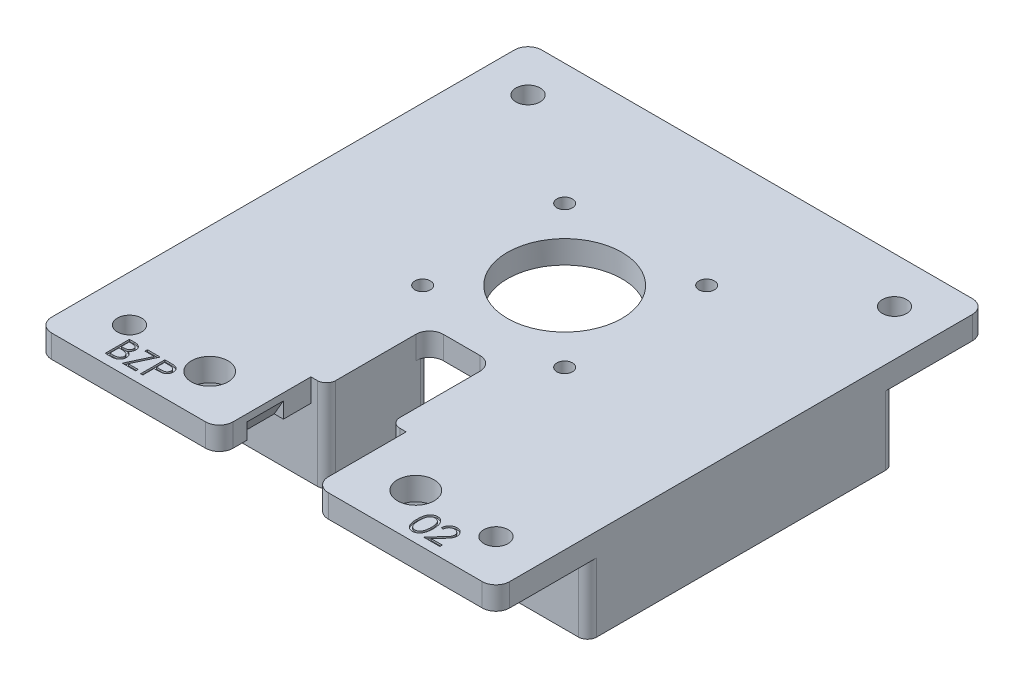
from build123d import *

# Parameters (mm, degrees)
SKETCH2_W               = 100
SKETCH2_H               = 107
BOSS_EXTRUDE1_DEPTH     = 5
CUT_EXTRUDE1_DEPTH      = 147.540096902
CUT_EXTRUDE1_DEPTH_BACK = 147.540096902
SKETCH3_R               = 12.5
SKETCH3_R_2             = 1.7
SKETCH3_R_3             = 4
M5_CLEARANCE_HOLE1_D    = 5.3
FILLET1_R               = 3
BOSS_EXTRUDE2_DEPTH     = 15
FILLET3_R               = 3
FILLET4_R               = 2
CUT_EXTRUDE2_DEPTH      = 4
CUT_EXTRUDE2_DEPTH_BACK = 4
CUT_EXTRUDE3_DEPTH      = 0.4
CUT_EXTRUDE4_DEPTH      = 0.4


with BuildPart() as part:
    # Sketch2 → Boss-Extrude1 (new body)
    with BuildSketch(Plane(origin=(0, 0, 0), x_dir=(1, 0, 0), z_dir=(0, 1, 0))):
        with Locations((50, 53.5)):
            Rectangle(SKETCH2_W, SKETCH2_H)
    extrude(amount=BOSS_EXTRUDE1_DEPTH)

    # Sketch3 → Cut-Extrude1 (cut, two sides: drawn at the far end of the back side and taken through both)
    with BuildSketch(Plane(origin=(0, 5, 0), x_dir=(1, 0, 0), z_dir=(0, 1, 0)).offset(-CUT_EXTRUDE1_DEPTH_BACK)):
        with Locations(Location((50, 65, 0), (0, 0, 270))):
            Circle(SKETCH3_R)
        with Locations(Location((65.5, 49.5, 0), (0, 0, 270))):
            Circle(SKETCH3_R_2)
        with Locations(Location((34.5, 49.5, 0), (0, 0, 270))):
            Circle(SKETCH3_R_2)
        with Locations(Location((65.5, 80.5, 0), (0, 0, 270))):
            Circle(SKETCH3_R_2)
        with Locations(Location((34.5, 80.5, 0), (0, 0, 270))):
            Circle(SKETCH3_R_2)
        with Locations(Location((27.5, 10, 0), (0, 0, 270))):
            Circle(SKETCH3_R_3)
        with Locations(Location((72.5, 10, 0), (0, 0, 90))):
            Circle(SKETCH3_R_3)
        Polygon((39.6, 0), (39.6, 20), (43, 20), (43, 42.5), (57, 42.5), (57, 20), (60.4, 20), (60.4, 0), align=None)
    extrude(amount=CUT_EXTRUDE1_DEPTH + CUT_EXTRUDE1_DEPTH_BACK, mode=Mode.SUBTRACT)

    # M5 Clearance Hole1 (through all)
    with Locations(Plane(origin=(0, 5, 0), x_dir=(1, 0, 0), z_dir=(0, 1, 0))):
        with Locations((10, 97), (10, 10), (90, 10), (90, 97)):
            Hole(M5_CLEARANCE_HOLE1_D / 2)

    # Fillet1
    fillet1_edges = [part.edges().sort_by_distance(p)[0] for p in [
        (60.4, 2.5, 0),
        (39.6, 2.5, 0),
        (43, 2.5, -42.5),
        (57, 2.5, -42.5),
        (0, 2.5, -107),
        (100, 2.5, -107),
        (100, 2.5, 0),
        (0, 2.5, 0),
    ]]
    fillet(fillet1_edges, radius=FILLET1_R)

    # Sketch7 → Boss-Extrude2 (add)
    with BuildSketch(Plane.XZ):
        Polygon((57, -20), (100, -20), (100, -87), (84, -87), (84, -82), (95, -82), (95, -25), (62, -25), (62, -42.5), (57, -42.5), (57, -25), align=None)
        Polygon((43, -25), (43, -20), (0, -20), (0, -87), (16, -87), (16, -82), (5, -82), (5, -25), (38, -25), (38, -42.5), (43, -42.5), align=None)
    extrude(amount=BOSS_EXTRUDE2_DEPTH)

    # Fillet3
    fillet3_edges = [part.edges().sort_by_distance(p)[0] for p in [
        (62, -7.5, -25),
        (95, -7.5, -25),
        (95, -7.5, -82),
        (5, -7.5, -82),
        (5, -7.5, -25),
        (38, -7.5, -25),
    ]]
    fillet(fillet3_edges, radius=FILLET3_R)

    # Fillet4
    fillet4_edges = [part.edges().sort_by_distance(p)[0] for p in [
        (57, -7.5, -42.5),
        (62, -7.5, -42.5),
        (84, -7.5, -82),
        (84, -7.5, -87),
        (100, -7.5, -87),
        (100, -7.5, -20),
        (43, -7.5, -42.5),
        (0, -7.5, -20),
        (0, -7.5, -87),
        (16, -7.5, -87),
        (16, -7.5, -82),
        (38, -7.5, -42.5),
        (43, -5, -20),
        (57, -5, -20),
    ]]
    fillet(fillet4_edges, radius=FILLET4_R)

    # Sketch9 → Cut-Extrude2 (cut, two sides: drawn at the far end of the back side and taken through both)
    with BuildSketch(Plane.XY.offset(-10).offset(-CUT_EXTRUDE2_DEPTH_BACK)):
        Polygon((39.6, 0), (39.6, 3.464101615), (37.6, 0), align=None)
        Polygon((60.4, 0), (62.4, 0), (60.4, 3.464101615), align=None)
    extrude(amount=CUT_EXTRUDE2_DEPTH + CUT_EXTRUDE2_DEPTH_BACK, mode=Mode.SUBTRACT)

    # Sketch10 → Cut-Extrude3 (cut)
    # profile 1 of 3: a face of its own
    with BuildSketch(Plane(origin=(0, 5, 0), x_dir=(1, 0, 0), z_dir=(0, 1, 0))):
        with BuildLine():
            Line((12.690491453, 7.291666667), (13.722960069, 7.291666667))
            add(Edge.make_bspline(
                [(13.722960069, 7.291666667), (13.773500745, 7.291400949), (13.871461152, 7.290885921), (14.013911975, 7.28289833), (14.147335772, 7.272007068), (14.271771237, 7.254725856), (14.387160871, 7.233874002), (14.493852417, 7.208622447), (14.591506606, 7.178344115), (14.70809372, 7.13019557), (14.841021386, 7.058647447), (14.984952289, 6.952922116), (15.108027746, 6.823605178), (15.214142773, 6.677732592), (15.298508752, 6.517265413), (15.359543285, 6.346028306), (15.398184358, 6.166229958), (15.4021583, 6.042793249), (15.404166667, 5.980410323)],
                knots=[0, 0, 0, 0, 1.001505555, 1.941167018, 2.826882275, 3.653841531, 4.429895133, 5.150066043, 5.825578002, 6.45369114, 7.647487171, 8.808567382, 9.977351308, 11.170798116, 12.373658725, 13.556498008, 14.765093433, 16, 16, 16, 16], degree=3))
            add(Edge.make_bspline(
                [(15.404166667, 5.980410323), (15.402513824, 5.92197134), (15.399265834, 5.807133228), (15.368207138, 5.639169515), (15.31958327, 5.479283743), (15.251993191, 5.328059423), (15.164148507, 5.188913365), (15.060041287, 5.060723093), (14.934437073, 4.948916138), (14.840331222, 4.886409607), (14.792529714, 4.854659121)],
                knots=[0, 0, 0, 0, 1.044552857, 2.05264487, 3.044412934, 4.028983338, 5.005914585, 5.980388656, 6.974128949, 8, 8, 8, 8], degree=3))
            add(Edge.make_bspline(
                [(14.792529714, 4.854659121), (14.852643694, 4.831579897), (14.967656629, 4.787423623), (15.125931909, 4.709355719), (15.262297925, 4.624443957), (15.377803134, 4.531716041), (15.476587446, 4.431765815), (15.56284606, 4.323127725), (15.636447661, 4.204384603), (15.699513629, 4.076774496), (15.748724248, 3.941600431), (15.785578294, 3.800130329), (15.806695747, 3.652871478), (15.809700871, 3.552654297), (15.811217949, 3.502061632)],
                knots=[0, 0, 0, 0, 1.27268992, 2.434971085, 3.483601985, 4.442670788, 5.356604649, 6.2567628, 7.179492994, 8.113709626, 9.066344395, 10.018646069, 10.999752585, 12, 12, 12, 12], degree=3))
            add(Edge.make_bspline(
                [(15.811217949, 3.502061632), (15.809741051, 3.450404575), (15.806835212, 3.348767869), (15.785396445, 3.199459511), (15.749096962, 3.05677358), (15.699096538, 2.919787173), (15.633839229, 2.788765303), (15.55442195, 2.663559534), (15.459728991, 2.545427868), (15.353800605, 2.433057628), (15.23396379, 2.332020378), (15.104672113, 2.242038298), (14.96429732, 2.168036514), (14.8151449, 2.105873005), (14.655541708, 2.058388312), (14.486204433, 2.025167873), (14.307279119, 2.002784067), (14.18449771, 2.000943769), (14.121531116, 2)],
                knots=[0, 0, 0, 0, 0.978564426, 1.925352924, 2.850884081, 3.763762016, 4.682927383, 5.618979971, 6.567305752, 7.547517671, 8.540179244, 9.531824382, 10.526200242, 11.540722885, 12.589160233, 13.674978461, 14.80764778, 16, 16, 16, 16], degree=3))
            Line((14.121531116, 2), (12.690491453, 2))
            Line((12.690491453, 2), (12.690491453, 7.291666667))
        make_face()
        with BuildLine():
            Line((13.165384615, 6.748931624), (13.165384615, 5.052884615))
            Line((13.165384615, 5.052884615), (13.484453459, 5.052884615))
            add(Edge.make_bspline(
                [(13.484453459, 5.052884615), (13.531093899, 5.053489261), (13.621212735, 5.054657559), (13.751720198, 5.058004186), (13.872861595, 5.067375038), (13.984427819, 5.076743196), (14.08624318, 5.091975013), (14.178082114, 5.11010596), (14.261385945, 5.129281305), (14.357451686, 5.161892315), (14.46641912, 5.210088324), (14.582583456, 5.284885029), (14.684991523, 5.373973039), (14.771468224, 5.476768898), (14.842242709, 5.58995944), (14.89140035, 5.711738653), (14.924733744, 5.839071471), (14.92774475, 5.926487163), (14.929273504, 5.970870059)],
                knots=[0, 0, 0, 0, 1.156816544, 2.235205308, 3.236616184, 4.169592532, 5.011045266, 5.787822928, 6.49130361, 7.128639758, 8.301311294, 9.436451833, 10.541879658, 11.654887649, 12.756523258, 13.837046038, 14.901820046, 16, 16, 16, 16], degree=3))
            add(Edge.make_bspline(
                [(14.929273504, 5.970870059), (14.92847797, 6.000239975), (14.926917442, 6.057852274), (14.914136854, 6.141837607), (14.89241445, 6.220825185), (14.864513316, 6.295897471), (14.825523275, 6.364707054), (14.77961661, 6.429633076), (14.72415134, 6.488464493), (14.66101826, 6.543451711), (14.588433795, 6.592202366), (14.506441246, 6.63489971), (14.413931306, 6.669281599), (14.312463061, 6.699392924), (14.200474631, 6.720541893), (14.079258342, 6.738160705), (13.947821326, 6.747130446), (13.856887659, 6.74831784), (13.809882479, 6.748931624)],
                knots=[0, 0, 0, 0, 0.91205012, 1.789085906, 2.630437955, 3.453916878, 4.269457761, 5.079663411, 5.91843418, 6.774407191, 7.675494373, 8.627863946, 9.638891023, 10.736472738, 11.911756761, 13.175263542, 14.539845004, 16, 16, 16, 16], degree=3))
            Line((13.809882479, 6.748931624), (13.165384615, 6.748931624))
        make_face(mode=Mode.SUBTRACT)
        with BuildLine():
            Line((13.165384615, 4.510149573), (13.165384615, 2.542735043))
            Line((13.165384615, 2.542735043), (13.84168336, 2.542735043))
            add(Edge.make_bspline(
                [(13.84168336, 2.542735043), (13.890092927, 2.543315232), (13.983395984, 2.544433471), (14.118108558, 2.548084048), (14.242966346, 2.556387845), (14.357399599, 2.569459547), (14.462643974, 2.583638869), (14.55743693, 2.602705924), (14.642546877, 2.624551377), (14.741235414, 2.658318518), (14.852365718, 2.710776277), (14.972124989, 2.789870406), (15.078602723, 2.884097311), (15.169022579, 2.993152384), (15.24312555, 3.111733081), (15.297033203, 3.237440931), (15.330281284, 3.368198812), (15.33430623, 3.457350865), (15.336324786, 3.502061632)],
                knots=[0, 0, 0, 0, 1.160039823, 2.235823828, 3.228722157, 4.157150951, 4.99529583, 5.772374946, 6.472645482, 7.099169577, 8.269452708, 9.405989375, 10.527446681, 11.663510218, 12.788923519, 13.866172445, 14.929861265, 16, 16, 16, 16], degree=3))
            add(Edge.make_bspline(
                [(15.336324786, 3.502061632), (15.335907343, 3.530021802), (15.335079189, 3.585491141), (15.322589926, 3.667006724), (15.304426099, 3.745967271), (15.280944051, 3.822587188), (15.24674557, 3.895481221), (15.206821389, 3.966091044), (15.160010699, 4.034509995), (15.087070115, 4.121009473), (14.980976757, 4.220669719), (14.830229609, 4.318244276), (14.658821491, 4.396935603), (14.534501353, 4.430347907), (14.470280783, 4.447607839)],
                knots=[0, 0, 0, 0, 0.723448775, 1.435228256, 2.130040452, 2.821711965, 3.505591119, 4.210454504, 4.921174351, 5.648778258, 7.137944449, 8.670945889, 10.280296675, 12, 12, 12, 12], degree=3))
            add(Edge.make_bspline(
                [(14.470280783, 4.447607839), (14.444534411, 4.452831597), (14.388710968, 4.464157782), (14.297682841, 4.476113476), (14.193760753, 4.486764936), (14.076704736, 4.49464371), (13.946366691, 4.502787651), (13.802468254, 4.505954821), (13.645597076, 4.509733464), (13.536751466, 4.510007322), (13.480213341, 4.510149573)],
                knots=[0, 0, 0, 0, 0.634451884, 1.375622551, 2.216452059, 3.157844607, 4.20941857, 5.370758133, 6.634282058, 8, 8, 8, 8], degree=3))
            Line((13.480213341, 4.510149573), (13.165384615, 4.510149573))
        make_face(mode=Mode.SUBTRACT)
    # profile 2 of 3: a face of its own
    with BuildSketch(Plane(origin=(0, 5, 0), x_dir=(1, 0, 0), z_dir=(0, 1, 0))):
        Polygon((16.625320513, 6.748931624), (16.625320513, 7.291666667), (19.406837607, 7.291666667), (17.187136084, 2.542735043), (19.338995726, 2.542735043), (19.338995726, 2), (16.421794872, 2), (18.641496394, 6.748931624), align=None)
    # profile 3 of 3: a face of its own
    with BuildSketch(Plane(origin=(0, 5, 0), x_dir=(1, 0, 0), z_dir=(0, 1, 0))):
        with BuildLine():
            Line((20.424465812, 7.291666667), (21.462234575, 7.291666667))
            add(Edge.make_bspline(
                [(21.462234575, 7.291666667), (21.533612969, 7.291588204), (21.670377142, 7.291437867), (21.866493952, 7.286879859), (22.044611046, 7.280791884), (22.20434436, 7.272352593), (22.346185366, 7.262379177), (22.469492235, 7.248390974), (22.575234184, 7.233785528), (22.638592744, 7.218936496), (22.667487981, 7.212164463)],
                knots=[0, 0, 0, 0, 1.415646017, 2.712440637, 3.8905458, 4.950247383, 5.884950622, 6.709939814, 7.411656543, 8, 8, 8, 8], degree=3))
            add(Edge.make_bspline(
                [(22.667487981, 7.212164463), (22.7040663, 7.202152706), (22.776361015, 7.182365105), (22.88053283, 7.142732452), (22.979644002, 7.095739178), (23.074034572, 7.042181555), (23.162544626, 6.979761714), (23.246494712, 6.911009935), (23.325143968, 6.834338873), (23.39805012, 6.750608468), (23.465004516, 6.661224342), (23.522652965, 6.564852161), (23.570923892, 6.463114119), (23.61232479, 6.356080981), (23.642122096, 6.242853944), (23.664569195, 6.124219748), (23.678816822, 6.00019111), (23.68018141, 5.915433929), (23.680876068, 5.872287326)],
                knots=[0, 0, 0, 0, 0.999701418, 1.975846123, 2.934577507, 3.890451536, 4.834027766, 5.787354733, 6.749476667, 7.726910423, 8.712836071, 9.690891519, 10.682875813, 11.679750201, 12.712814741, 13.765529915, 14.8625177, 16, 16, 16, 16], degree=3))
            add(Edge.make_bspline(
                [(23.680876068, 5.872287326), (23.680238914, 5.828778069), (23.678992279, 5.743649267), (23.664030038, 5.619109456), (23.643876058, 5.500094748), (23.612886467, 5.386869031), (23.572298366, 5.280104711), (23.524685382, 5.178170229), (23.467257901, 5.082799773), (23.401271075, 4.993647107), (23.327865689, 4.910628549), (23.247352318, 4.834345705), (23.160056006, 4.765245098), (23.066254187, 4.703171817), (22.965032392, 4.649565299), (22.857925803, 4.601551279), (22.744003452, 4.561227175), (22.665168937, 4.540015058), (22.625086806, 4.529230101)],
                knots=[0, 0, 0, 0, 1.121902311, 2.195077645, 3.232258892, 4.234102512, 5.217864754, 6.176164875, 7.132989551, 8.084763148, 9.034132444, 9.988522005, 10.94243251, 11.903244335, 12.886203696, 13.894208494, 14.929344452, 16, 16, 16, 16], degree=3))
            add(Edge.make_bspline(
                [(22.625086806, 4.529230101), (22.591934765, 4.522180118), (22.51928014, 4.50672967), (22.399623882, 4.48948117), (22.260308834, 4.474758845), (22.101525149, 4.46372022), (21.923415352, 4.454270258), (21.725883094, 4.446758973), (21.50854062, 4.442631694), (21.356940049, 4.442418829), (21.277789463, 4.442307692)],
                knots=[0, 0, 0, 0, 0.601384939, 1.31797006, 2.144135048, 3.087295005, 4.142315834, 5.309527816, 6.595305764, 8, 8, 8, 8], degree=3))
            Line((21.277789463, 4.442307692), (20.899358974, 4.442307692))
            Line((20.899358974, 4.442307692), (20.899358974, 2))
            Line((20.899358974, 2), (20.424465812, 2))
            Line((20.424465812, 2), (20.424465812, 7.291666667))
        make_face()
        with BuildLine():
            Line((20.899358974, 6.748931624), (20.899358974, 4.985042735))
            Line((20.899358974, 4.985042735), (21.825824653, 4.973382412))
            add(Edge.make_bspline(
                [(21.825824653, 4.973382412), (21.871060731, 4.973359032), (21.958388048, 4.973313899), (22.084535671, 4.979339177), (22.201571141, 4.986294744), (22.309134963, 4.996478819), (22.407275626, 5.010874054), (22.496156771, 5.025406086), (22.575089211, 5.04642967), (22.667465385, 5.074737167), (22.770400922, 5.123016241), (22.882384001, 5.19309286), (22.97728715, 5.282417265), (23.059411241, 5.382849819), (23.124583223, 5.494578265), (23.172292878, 5.614122967), (23.200325342, 5.74025793), (23.20408423, 5.826569759), (23.205982906, 5.870167268)],
                knots=[0, 0, 0, 0, 1.160613943, 2.240541288, 3.23993089, 4.169200891, 5.011653406, 5.7853311, 6.478053781, 7.106038997, 8.262395093, 9.384106736, 10.481365981, 11.59014053, 12.70357646, 13.786202915, 14.881775077, 16, 16, 16, 16], degree=3))
            add(Edge.make_bspline(
                [(23.205982906, 5.870167268), (23.204073905, 5.91271002), (23.200279047, 5.997279747), (23.172073158, 6.121223825), (23.124675981, 6.239508759), (23.058973749, 6.349837114), (22.979234184, 6.449908282), (22.886555415, 6.536838463), (22.781155603, 6.606721275), (22.683111254, 6.651826356), (22.596023746, 6.679366117), (22.520380188, 6.698635102), (22.434971668, 6.71401965), (22.339770382, 6.726476993), (22.235514217, 6.737141155), (22.121307479, 6.744377097), (21.997582804, 6.748612632), (21.911690631, 6.748822719), (21.867165799, 6.748931624)],
                knots=[0, 0, 0, 0, 1.120700087, 2.227813068, 3.331159281, 4.466773991, 5.599788987, 6.693661531, 7.80175334, 8.91857717, 9.525282508, 10.207424825, 10.974604443, 11.810962634, 12.737642355, 13.736264703, 14.826523623, 16, 16, 16, 16], degree=3))
            Line((21.867165799, 6.748931624), (20.899358974, 6.748931624))
        make_face(mode=Mode.SUBTRACT)
    extrude(amount=-CUT_EXTRUDE3_DEPTH, mode=Mode.SUBTRACT)

    # Sketch11 → Cut-Extrude4 (cut)
    # profile 1 of 2: a face of its own
    with BuildSketch(Plane(origin=(0, 5, 0), x_dir=(1, 0, 0), z_dir=(0, 1, 0))):
        with BuildLine():
            add(Edge.make_bspline(
                [(78.083012821, 4.643713275), (78.083508753, 4.728527182), (78.084472108, 4.89327942), (78.095189126, 5.133346677), (78.112992322, 5.358560447), (78.137390493, 5.568931511), (78.167081248, 5.764514179), (78.206716567, 5.944785776), (78.251790686, 6.110580657), (78.304030693, 6.262439469), (78.362976517, 6.402408139), (78.427133078, 6.533074812), (78.499046517, 6.654241781), (78.57460685, 6.767842965), (78.65687272, 6.872018789), (78.743503034, 6.968240433), (78.837878966, 7.054284068), (78.936792324, 7.132670739), (79.041138645, 7.201386012), (79.147943628, 7.2619117), (79.257942419, 7.313618642), (79.371435339, 7.35427442), (79.487402301, 7.387855105), (79.606248699, 7.410819348), (79.728170762, 7.425268483), (79.810465907, 7.426649862), (79.852201856, 7.427350427)],
                knots=[0, 0, 0, 0, 1.646270934, 3.197905019, 4.663502075, 6.030701355, 7.308322542, 8.50163776, 9.611534131, 10.641858119, 11.616356847, 12.558055219, 13.465016945, 14.349605745, 15.204443733, 16.039544428, 16.859896111, 17.680448484, 18.487036065, 19.28249412, 20.06191084, 20.843045899, 21.620316918, 22.403196591, 23.190181807, 24, 24, 24, 24], degree=3))
            add(Edge.make_bspline(
                [(79.852201856, 7.427350427), (79.894286449, 7.426612897), (79.977979462, 7.425146182), (80.101714315, 7.411049269), (80.22259062, 7.387658404), (80.340093044, 7.354515978), (80.455186773, 7.313398705), (80.56697158, 7.261862231), (80.676141811, 7.201871562), (80.780962603, 7.1313807), (80.8825847, 7.052788449), (80.978511977, 6.96394489), (81.068753166, 6.8657471), (81.15444083, 6.759245711), (81.233143936, 6.642398023), (81.308094244, 6.517236333), (81.375180536, 6.381571812), (81.439791295, 6.237668009), (81.495560906, 6.081543192), (81.545856301, 5.914077423), (81.586494741, 5.73329264), (81.620345189, 5.540137365), (81.64656902, 5.333902241), (81.665668371, 5.115029359), (81.67575744, 4.883374721), (81.677657453, 4.72499083), (81.678632479, 4.643713275)],
                knots=[0, 0, 0, 0, 0.810914788, 1.612654377, 2.396697861, 3.181598691, 3.963628158, 4.749916497, 5.551656086, 6.361998678, 7.18212741, 8.025565596, 8.878627764, 9.750805457, 10.657531673, 11.591944965, 12.560506719, 13.57287815, 14.630710178, 15.753379473, 16.941251878, 18.199788006, 19.531962791, 20.947069417, 22.433333509, 24, 24, 24, 24], degree=3))
            add(Edge.make_bspline(
                [(81.678632479, 4.643713275), (81.677647345, 4.562790223), (81.675727852, 4.405114958), (81.665781474, 4.17450265), (81.646189258, 3.956791323), (81.621681299, 3.751458838), (81.587737581, 3.559359819), (81.546001199, 3.379829522), (81.49966083, 3.212092651), (81.442458225, 3.057523353), (81.379849174, 2.913965391), (81.311730009, 2.779909107), (81.238750629, 2.654169593), (81.159241455, 2.537753309), (81.074494032, 2.429835578), (80.982694518, 2.332321315), (80.886430658, 2.242860894), (80.784509505, 2.163256648), (80.678053946, 2.093580812), (80.569258674, 2.031269396), (80.456193321, 1.981024726), (80.341420166, 1.937882461), (80.223297518, 1.904922254), (80.101972617, 1.88213202), (79.978062594, 1.866148392), (79.894300704, 1.864929072), (79.852201856, 1.864316239)],
                knots=[0, 0, 0, 0, 1.561518951, 3.042555995, 4.452378317, 5.7783523, 7.031515105, 8.214008947, 9.334062868, 10.386615937, 11.391082383, 12.354592575, 13.286541444, 14.194233754, 15.072674879, 15.931287219, 16.775624067, 17.606195743, 18.42308326, 19.229000347, 20.022332153, 20.807536673, 21.593273796, 22.3848459, 23.188221202, 24, 24, 24, 24], degree=3))
            add(Edge.make_bspline(
                [(79.852201856, 1.864316239), (79.810467065, 1.865021324), (79.728174202, 1.866411614), (79.606235416, 1.88079547), (79.487879817, 1.903920815), (79.372523368, 1.93630068), (79.259574232, 1.975935016), (79.150571513, 2.027572133), (79.044303229, 2.087041499), (78.9410529, 2.15476791), (78.842760705, 2.232361407), (78.748873527, 2.318183606), (78.661749987, 2.414376144), (78.580660342, 2.519420147), (78.503592375, 2.632349216), (78.432700109, 2.754705208), (78.367127508, 2.886002965), (78.307190326, 3.027090758), (78.254048894, 3.180027375), (78.207107716, 3.346562443), (78.170044645, 3.528165845), (78.138320415, 3.723379007), (78.112732359, 3.933040783), (78.09526332, 4.157264995), (78.084466332, 4.395911918), (78.083506166, 4.559605505), (78.083012821, 4.643713275)],
                knots=[0, 0, 0, 0, 0.810891512, 1.598919785, 2.382837074, 3.152667961, 3.926044502, 4.706494248, 5.493654104, 6.291793342, 7.103789334, 7.925228297, 8.761435821, 9.622817696, 10.50288917, 11.416980706, 12.369136599, 13.353924996, 14.394355917, 15.514179734, 16.714354668, 17.994756427, 19.357759367, 20.818452758, 22.365282078, 24, 24, 24, 24], degree=3))
        make_face()
        with BuildLine():
            add(Edge.make_bspline(
                [(78.557905983, 4.645833333), (78.558086575, 4.575153753), (78.55843707, 4.437978566), (78.567593469, 4.238644112), (78.580067034, 4.052724686), (78.596155662, 3.879984221), (78.620048215, 3.721007416), (78.646819192, 3.574700871), (78.679397851, 3.441838858), (78.71794389, 3.321509668), (78.761848239, 3.211671195), (78.809784485, 3.109464596), (78.861281054, 3.013682502), (78.918913579, 2.925185261), (78.981680401, 2.843684275), (79.048163781, 2.767737016), (79.12084495, 2.700008247), (79.221392275, 2.618778359), (79.354132183, 2.534838716), (79.521379776, 2.461744033), (79.693235648, 2.415808652), (79.809880991, 2.409967021), (79.868102297, 2.407051282)],
                knots=[0, 0, 0, 0, 1.459021318, 2.831673884, 4.118529203, 5.306027144, 6.411944654, 7.436330062, 8.375795394, 9.233974572, 10.042671642, 10.816086306, 11.563610507, 12.285937304, 12.993564865, 13.685989202, 14.367179055, 15.041617293, 16.353048772, 17.594441528, 18.799311195, 20, 20, 20, 20], degree=3))
            add(Edge.make_bspline(
                [(79.868102297, 2.407051282), (79.926700205, 2.409466974), (80.043775039, 2.414293372), (80.214822563, 2.460858129), (80.380875471, 2.531115647), (80.511008048, 2.614191043), (80.610011417, 2.693306493), (80.680945438, 2.760759592), (80.746051154, 2.836288106), (80.807800481, 2.917778708), (80.864435036, 3.006788297), (80.915935256, 3.102888858), (80.962930317, 3.206347257), (80.989704708, 3.278570554), (81.003393763, 3.315496461)],
                knots=[0, 0, 0, 0, 1.353760809, 2.704726607, 4.075137775, 5.516104923, 6.260822281, 7.007110065, 7.778089737, 8.566572457, 9.372053459, 10.217411131, 11.088608312, 12, 12, 12, 12], degree=3))
            add(Edge.make_bspline(
                [(81.003393763, 3.315496461), (81.019347031, 3.362712853), (81.051739007, 3.458582377), (81.09348538, 3.607298851), (81.126362353, 3.763331602), (81.155940298, 3.925748147), (81.176128847, 4.095746266), (81.192378517, 4.272799966), (81.201949913, 4.45704274), (81.203136382, 4.582220881), (81.203739316, 4.645833333)],
                knots=[0, 0, 0, 0, 0.884706709, 1.796334032, 2.740027952, 3.714592787, 4.726048262, 5.777819803, 6.87074269, 8, 8, 8, 8], degree=3))
            add(Edge.make_bspline(
                [(81.203739316, 4.645833333), (81.202907483, 4.709435497), (81.201280238, 4.833854924), (81.19506028, 5.016066935), (81.178998447, 5.189131288), (81.161159303, 5.353793551), (81.134856362, 5.509142222), (81.106496345, 5.656477803), (81.068394512, 5.793974995), (81.027694376, 5.923786506), (80.981111992, 6.044437495), (80.929834632, 6.156490482), (80.875070782, 6.260486435), (80.815589062, 6.356140025), (80.752095588, 6.443879703), (80.682914532, 6.521946292), (80.610790063, 6.592759327), (80.509768842, 6.67358964), (80.377516047, 6.756006132), (80.212951794, 6.831851984), (80.041697368, 6.875407378), (79.925925598, 6.881548262), (79.868102297, 6.884615385)],
                knots=[0, 0, 0, 0, 1.31362396, 2.569729283, 3.763502607, 4.902122613, 5.988968491, 7.01645872, 7.998833611, 8.933434873, 9.825090667, 10.667526885, 11.477055099, 12.250526234, 12.991942729, 13.710640831, 14.402115721, 15.076753259, 16.378508321, 17.609869233, 18.806226677, 20, 20, 20, 20], degree=3))
            add(Edge.make_bspline(
                [(79.868102297, 6.884615385), (79.809575568, 6.881544031), (79.69241549, 6.875395728), (79.519381082, 6.832014261), (79.35351855, 6.75639942), (79.221615482, 6.673316666), (79.120523804, 6.594186124), (79.049339256, 6.525566128), (78.982594448, 6.450505719), (78.921108759, 6.368255205), (78.86352139, 6.279861138), (78.81063343, 6.184628125), (78.76298223, 6.082073562), (78.719009181, 5.972284428), (78.680345561, 5.851965619), (78.648453497, 5.719267259), (78.618990929, 5.573426066), (78.598133796, 5.413588238), (78.579592165, 5.240804506), (78.567676318, 5.054420942), (78.558406441, 4.854752176), (78.558076143, 4.716867734), (78.557905983, 4.645833333)],
                knots=[0, 0, 0, 0, 1.207732386, 2.417664972, 3.655092373, 4.956220595, 5.625982001, 6.301752483, 6.994047911, 7.697131622, 8.419323945, 9.170223765, 9.943494443, 10.752040957, 11.610060368, 12.549350801, 13.567764191, 14.679664412, 15.874934091, 17.154273443, 18.533957287, 20, 20, 20, 20], degree=3))
        make_face(mode=Mode.SUBTRACT)
    # profile 2 of 2: a face of its own
    with BuildSketch(Plane(origin=(0, 5, 0), x_dir=(1, 0, 0), z_dir=(0, 1, 0))):
        with BuildLine():
            Line((82.831944444, 5.663461538), (82.357051282, 5.663461538))
            add(Edge.make_bspline(
                [(82.357051282, 5.663461538), (82.360146382, 5.726463952), (82.366225077, 5.850199016), (82.394691657, 6.030605398), (82.435423698, 6.203045391), (82.493014349, 6.366134428), (82.564536935, 6.521314529), (82.650307334, 6.667969315), (82.751898036, 6.805539327), (82.86711536, 6.932749244), (82.99225366, 7.0494495), (83.127275735, 7.150225879), (83.269160479, 7.235372835), (83.417477427, 7.306555188), (83.573899946, 7.35998567), (83.737008552, 7.399630292), (83.907519866, 7.423482624), (84.023694661, 7.42604649), (84.082779113, 7.427350427)],
                knots=[0, 0, 0, 0, 1.10065271, 2.161652631, 3.183658789, 4.190468796, 5.17591951, 6.163126047, 7.15150782, 8.156236427, 9.156009102, 10.134482811, 11.092018607, 12.041330605, 13.001268258, 13.972401359, 14.968799086, 16, 16, 16, 16], degree=3))
            add(Edge.make_bspline(
                [(84.082779113, 7.427350427), (84.140803106, 7.425992047), (84.25481818, 7.423322877), (84.421221463, 7.400400845), (84.579634754, 7.364499772), (84.729748401, 7.314130035), (84.870364713, 7.246420246), (85.00254003, 7.165083492), (85.127847923, 7.071013032), (85.240646274, 6.960260243), (85.344223965, 6.842025685), (85.433580946, 6.715799926), (85.510103229, 6.585429459), (85.573886983, 6.449920154), (85.620840908, 6.307996099), (85.656488913, 6.161723542), (85.676638693, 6.009588411), (85.679731178, 5.906617786), (85.681303419, 5.854266827)],
                knots=[0, 0, 0, 0, 1.111607364, 2.184268762, 3.212621178, 4.221274766, 5.211760367, 6.196651075, 7.1921475, 8.207485113, 9.220403448, 10.201281604, 11.166441695, 12.114753415, 13.065576456, 14.026450734, 14.996634279, 16, 16, 16, 16], degree=3))
            add(Edge.make_bspline(
                [(85.681303419, 5.854266827), (85.678743367, 5.780564744), (85.673668188, 5.634453944), (85.630254785, 5.419740997), (85.562451131, 5.211712852), (85.48081227, 5.044288597), (85.398455123, 4.909376053), (85.324239486, 4.798298368), (85.237358165, 4.678698434), (85.136546626, 4.550976745), (85.02389026, 4.414132877), (84.898368656, 4.268249496), (84.759086725, 4.114833844), (84.66132923, 4.010050375), (84.610673745, 3.955754207)],
                knots=[0, 0, 0, 0, 1.184426356, 2.348067706, 3.509069118, 4.696110526, 5.333549288, 6.050745305, 6.844228056, 7.710549037, 8.667450064, 9.695053472, 10.805634456, 12, 12, 12, 12], degree=3))
            Line((84.610673745, 3.955754207), (83.286697049, 2.542735043))
            Line((83.286697049, 2.542735043), (85.749145299, 2.542735043))
            Line((85.749145299, 2.542735043), (85.749145299, 2))
            Line((85.749145299, 2), (82.153525641, 2))
            Line((82.153525641, 2), (84.205742521, 4.1900207))
            add(Edge.make_bspline(
                [(84.205742521, 4.1900207), (84.255707779, 4.242178854), (84.351680813, 4.342363993), (84.487423518, 4.488630135), (84.609341989, 4.624322893), (84.718225428, 4.749185889), (84.811711799, 4.865045521), (84.894673388, 4.968149418), (84.961145174, 5.063028171), (85.033286308, 5.173005051), (85.103157446, 5.307280816), (85.163198747, 5.471373418), (85.199809291, 5.640294383), (85.204201126, 5.754446273), (85.206410256, 5.811865652)],
                knots=[0, 0, 0, 0, 1.329631726, 2.553950428, 3.673215718, 4.687767853, 5.603093632, 6.413772471, 7.123043292, 7.734684054, 8.834405432, 9.900288307, 10.943827018, 12, 12, 12, 12], degree=3))
            add(Edge.make_bspline(
                [(85.206410256, 5.811865652), (85.205449075, 5.847972052), (85.20355477, 5.919130833), (85.186836584, 6.023460968), (85.161571891, 6.124100627), (85.125368941, 6.221359373), (85.07758256, 6.314259347), (85.019414474, 6.402913632), (84.952300926, 6.488621949), (84.874662697, 6.568984673), (84.789373851, 6.64258602), (84.699273022, 6.70778553), (84.603947269, 6.762273233), (84.503798513, 6.806940187), (84.399105958, 6.841979156), (84.289667117, 6.866258199), (84.175784378, 6.881501954), (84.098021831, 6.883564452), (84.058398438, 6.884615385)],
                knots=[0, 0, 0, 0, 0.991446411, 1.95395049, 2.89581595, 3.838931463, 4.798493298, 5.75982156, 6.748411868, 7.785213223, 8.824556874, 9.840280684, 10.836137867, 11.835679398, 12.848801643, 13.863922112, 14.911575587, 16, 16, 16, 16], degree=3))
            add(Edge.make_bspline(
                [(84.058398438, 6.884615385), (84.017016345, 6.883534324), (83.935748748, 6.881411299), (83.816430687, 6.866560367), (83.702605761, 6.84093987), (83.593987646, 6.805898946), (83.490392558, 6.761360425), (83.392324301, 6.705886002), (83.300003028, 6.63968953), (83.213255189, 6.564637737), (83.133329887, 6.481078387), (83.063106635, 6.387929991), (83.00174747, 6.286893303), (82.948212082, 6.178240947), (82.904736217, 6.060987018), (82.871514906, 5.93554775), (82.84522765, 5.802467804), (82.83644572, 5.710566545), (82.831944444, 5.663461538)],
                knots=[0, 0, 0, 0, 1.031018746, 2.02475058, 2.990194455, 3.934040569, 4.864654155, 5.795059489, 6.735614925, 7.690564532, 8.649604399, 9.611025574, 10.590972636, 11.591080095, 12.624614302, 13.701020113, 14.821632451, 16, 16, 16, 16], degree=3))
        make_face()
    extrude(amount=-CUT_EXTRUDE4_DEPTH, mode=Mode.SUBTRACT)


solid = part.part
